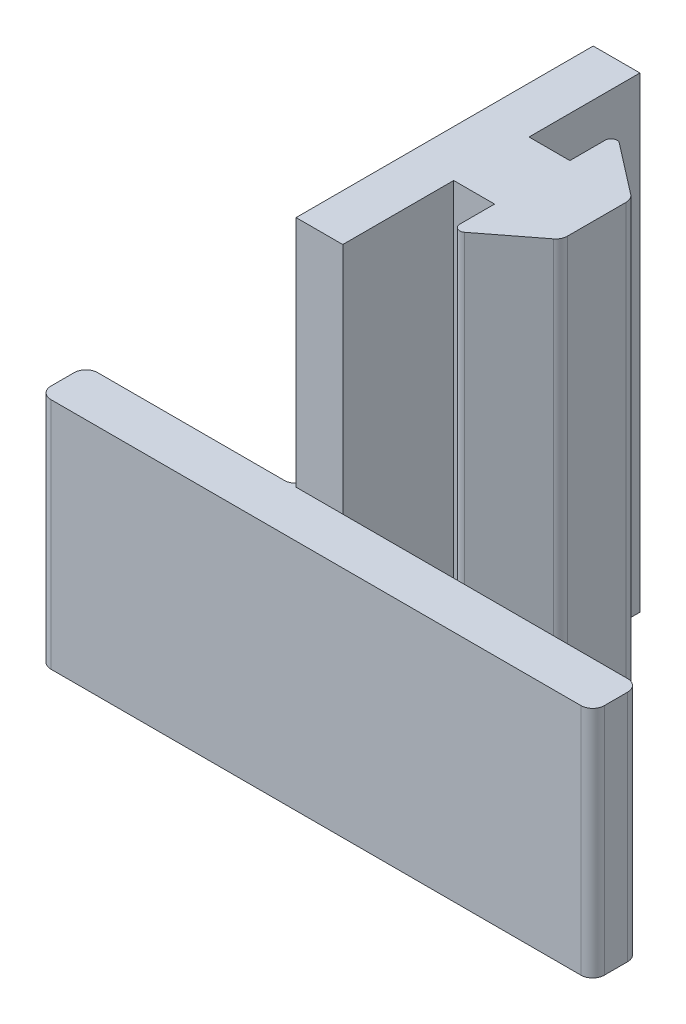
from build123d import *

# Parameters (mm, degrees)
MAIN_EXTRUDE_DEPTH = 40
CUT_EXTRUDE1_START = -4
SKETCH4_W          = 47.4
SKETCH4_H          = 20
CUT_EXTRUDE1_DEPTH = 4
FILLET1_R          = 1
FILLET2_R          = 1
FILLET3_R          = 1


with BuildPart() as part:
    # Sketch1 → Main-Extrude (new body)
    with BuildSketch(Plane(origin=(0, 0, 0), x_dir=(1, 0, 0), z_dir=(0, 1, 0))):
        with BuildLine():
            Line((6.5, 10.159541063), (6.5, 7.17778828))
            ThreePointArc((6.5, 7.17778828), (6.779616102, 6.728977699), (7.305723751, 6.782145779))
            Line((7.305723751, 6.782145779), (11.611447501, 10.10929595))
            ThreePointArc((11.611447501, 10.10929595), (11.897621162, 10.459813156), (12, 10.900580951))
            Line((12, 10.900580951), (12, 15.918501174))
            ThreePointArc((12, 15.918501174), (11.897621162, 16.35926897), (11.611447501, 16.709786176))
            Line((11.611447501, 16.709786176), (7.305723751, 20.036936346))
            ThreePointArc((7.305723751, 20.036936346), (6.779616102, 20.090104427), (6.5, 19.641293846))
            Line((6.5, 19.641293846), (6.5, 16.609541063))
            Line((6.5, 16.609541063), (3, 16.609541063))
            Line((3, 16.609541063), (3, 26.109541063))
            Line((3, 26.109541063), (-1, 26.109541063))
            Line((-1, 26.109541063), (-1, 0.659541063))
            Line((-1, 0.659541063), (-19, 0.659541063))
            Line((-19, 0.659541063), (-19, -3.340458937))
            Line((-19, -3.340458937), (-4.999912017, -3.340458937))
            Line((-4.999912017, -3.340458937), (28.4, -3.340458937))
            Line((28.4, -3.340458937), (28.4, 0.659541063))
            Line((28.4, 0.659541063), (3, 0.659541063))
            Line((3, 0.659541063), (3, 10.159541063))
            Line((3, 10.159541063), (6.5, 10.159541063))
        make_face()
    extrude(amount=MAIN_EXTRUDE_DEPTH)

    # Sketch4 → Cut-Extrude1 (cut)
    with BuildSketch(Plane.XY.offset(3.340458937).offset(CUT_EXTRUDE1_START)):
        with Locations((4.7, 30)):
            Rectangle(SKETCH4_W, SKETCH4_H)
    extrude(amount=CUT_EXTRUDE1_DEPTH, mode=Mode.SUBTRACT)

    # Fillet1
    fillet1_edges = [part.edges().sort_by_distance(p)[0] for p in [
        (28.4, 10, 3.340458937),
        (-19, 10, 3.340458937),
        (28.4, 10, -0.659541063),
    ]]
    fillet(fillet1_edges, radius=FILLET1_R)

    # Fillet2
    fillet2_edges = [part.edges().sort_by_distance(p)[0] for p in [
        (-19, 10, -0.659541063),
    ]]
    fillet(fillet2_edges, radius=FILLET2_R)

    # Fillet3
    fillet3_edges = [part.edges().sort_by_distance(p)[0] for p in [
        (-1, 10, -0.659541063),
    ]]
    fillet(fillet3_edges, radius=FILLET3_R)


solid = part.part
